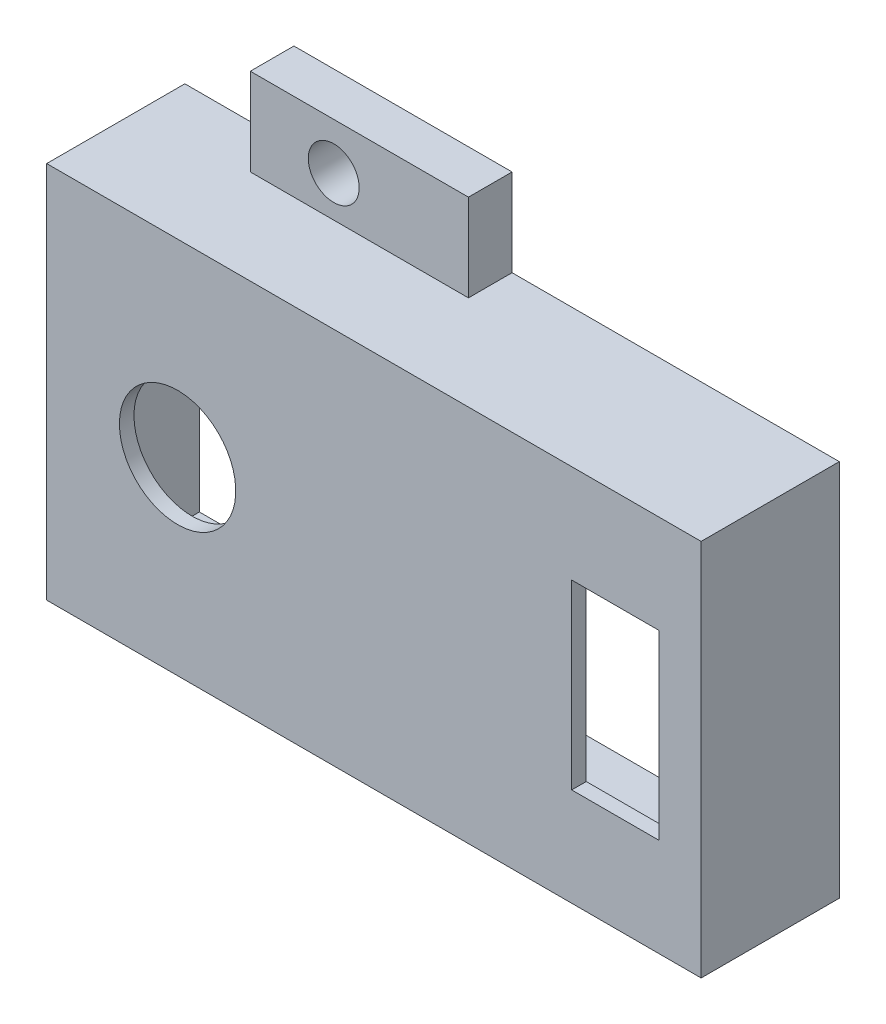
from build123d import *

# Parameters (mm, degrees)
SKETCH1_W           = 45
SKETCH1_H           = 26
BOSS_EXTRUDE2_DEPTH = 9.5
SHELL2_T            = -1
SKETCH2_R           = 4
SKETCH2_W           = 6
SKETCH2_H           = 12.5
CUT_EXTRUDE1_DEPTH  = 9.5
SKETCH3_W           = 15
SKETCH3_H           = 6
BOSS_EXTRUDE4_DEPTH = 3
SKETCH4_R           = 1.6
CUT_EXTRUDE2_DEPTH  = 9
SKETCH5_R           = 1.75
CUT_EXTRUDE3_DEPTH  = 9


with BuildPart() as part:
    # Sketch1 → Boss-Extrude2 (new body)
    with BuildSketch(Plane.XY):
        Rectangle(SKETCH1_W, SKETCH1_H)
    extrude(amount=BOSS_EXTRUDE2_DEPTH)

    # Shell2
    shell2_openings = [part.faces().sort_by_distance(p)[0] for p in [
        (0, 0, 0),
    ]]
    offset(amount=SHELL2_T, openings=shell2_openings, kind=Kind.INTERSECTION)

    # Sketch2 → Cut-Extrude1 (cut)
    with BuildSketch(Plane(origin=(0, 0, 8.5), x_dir=(-1, 0, 0), z_dir=(0, 0, -1))):
        with Locations((13.5, 0)):
            Circle(SKETCH2_R)
        with Locations((-16.6, 0)):
            Rectangle(SKETCH2_W, SKETCH2_H)
    extrude(amount=-CUT_EXTRUDE1_DEPTH, mode=Mode.SUBTRACT)

    # Sketch3 → Boss-Extrude4 (add)
    with BuildSketch(Plane(origin=(0, 0, 0), x_dir=(-1, 0, 0), z_dir=(0, 0, -1))):
        with Locations((7.5, 16)):
            Rectangle(SKETCH3_W, SKETCH3_H)
        with Locations((7.5, -16)):
            Rectangle(SKETCH3_W, SKETCH3_H)
    extrude(amount=-BOSS_EXTRUDE4_DEPTH)

    # Sketch4 → Cut-Extrude2 (cut)
    with BuildSketch(Plane.XY.offset(3)):
        with Locations((-8.674253425, -16.212560211)):
            Circle(SKETCH4_R)
    extrude(amount=-CUT_EXTRUDE2_DEPTH, mode=Mode.SUBTRACT)

    # Sketch5 → Cut-Extrude3 (cut)
    with BuildSketch(Plane.XY.offset(3)):
        with Locations((-9.262710237, 15.798173241)):
            Circle(SKETCH5_R)
    extrude(amount=-CUT_EXTRUDE3_DEPTH, mode=Mode.SUBTRACT)


solid = part.part
